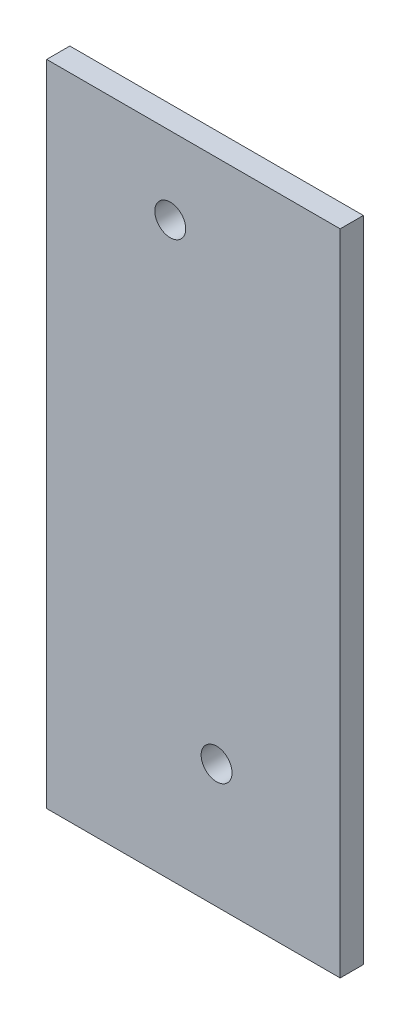
from build123d import *

# Parameters (mm, degrees)
ESQUISSE1_W             = 38
ESQUISSE1_H             = 320
BOSS_EXTRU_1_DEPTH      = 3
ENL_V_MAT_EXTRU_1_REACH = 192.418
ESQUISSE2_R             = 2
ENL_V_MAT_EXTRU_2_REACH = 192.418
ESQUISSE3_W             = 38
ESQUISSE3_H             = 236


with BuildPart() as part:
    # Esquisse1 → Boss.-Extru.1 (new body)
    with BuildSketch(Plane.XY):
        with Locations((76, 5)):
            Rectangle(ESQUISSE1_W, ESQUISSE1_H)
    extrude(amount=BOSS_EXTRU_1_DEPTH)

    # Esquisse2 → Enlèv. mat.-Extru.1 (cut, up to next)
    with BuildSketch(Plane.XY.offset(3), mode=Mode.PRIVATE) as enl_v_mat_extru_1_sk1:
        with Locations((73, 155)):
            Circle(ESQUISSE2_R)
    enl_v_mat_extru_1_tool1 = extrude(enl_v_mat_extru_1_sk1.sketch, amount=-ENL_V_MAT_EXTRU_1_REACH, mode=Mode.PRIVATE) & part.part
    # Esquisse2 → Enlèv. mat.-Extru.1 (cut, up to next)
    with BuildSketch(Plane.XY.offset(3), mode=Mode.PRIVATE) as enl_v_mat_extru_1_sk2:
        with Locations((79, 97)):
            Circle(ESQUISSE2_R)
    enl_v_mat_extru_1_tool2 = extrude(enl_v_mat_extru_1_sk2.sketch, amount=-ENL_V_MAT_EXTRU_1_REACH, mode=Mode.PRIVATE) & part.part
    add(enl_v_mat_extru_1_tool1.solids().sort_by_distance((73, 155, 3))[0], mode=Mode.SUBTRACT)
    add(enl_v_mat_extru_1_tool2.solids().sort_by_distance((79, 97, 3))[0], mode=Mode.SUBTRACT)

    # Esquisse3 → Enlèv. mat.-Extru.2 (cut, up to next)
    with BuildSketch(Plane.XY.offset(3), mode=Mode.PRIVATE) as enl_v_mat_extru_2_sk1:
        with Locations((76, -37)):
            Rectangle(ESQUISSE3_W, ESQUISSE3_H)
    enl_v_mat_extru_2_tool1 = extrude(enl_v_mat_extru_2_sk1.sketch, amount=-ENL_V_MAT_EXTRU_2_REACH, mode=Mode.PRIVATE) & part.part
    add(enl_v_mat_extru_2_tool1.solids().sort_by_distance((76, -37, 3))[0], mode=Mode.SUBTRACT)


solid = part.part
